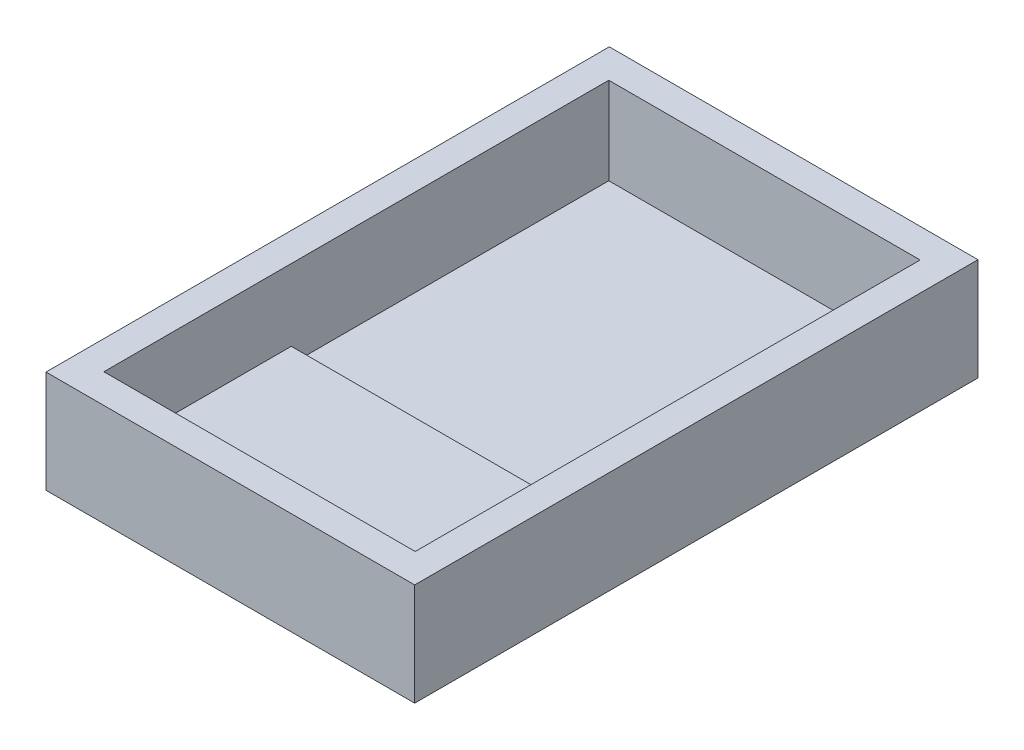
from build123d import *

# Parameters (mm, degrees)
SKETCH1_W           = 36
SKETCH1_H           = 55
BOSS_EXTRUDE1_DEPTH = 3
SKETCH2_W           = 36
SKETCH2_H           = 55
SKETCH2_W_2         = 30.4
SKETCH2_H_2         = 49.3
BOSS_EXTRUDE2_DEPTH = 7
SKETCH3_W           = 30.4
SKETCH3_H           = 31
CUT_EXTRUDE1_DEPTH  = 1.5


with BuildPart() as part:
    # Sketch1 → Boss-Extrude1 (new body)
    with BuildSketch(Plane(origin=(0, 0, 0), x_dir=(1, 0, 0), z_dir=(0, 1, 0))):
        with Locations((18, 27.5)):
            Rectangle(SKETCH1_W, SKETCH1_H)
    extrude(amount=BOSS_EXTRUDE1_DEPTH)

    # Sketch2 → Boss-Extrude2 (add)
    with BuildSketch(Plane(origin=(0, 3, 0), x_dir=(1, 0, 0), z_dir=(0, 1, 0))):
        with Locations((18, 27.5)):
            Rectangle(SKETCH2_W, SKETCH2_H)
        with Locations((18, 27.5)):
            Rectangle(SKETCH2_W_2, SKETCH2_H_2, mode=Mode.SUBTRACT)
    extrude(amount=BOSS_EXTRUDE2_DEPTH)

    # Sketch3 → Cut-Extrude1 (cut)
    with BuildSketch(Plane(origin=(0, 3, 0), x_dir=(1, 0, 0), z_dir=(0, 1, 0))):
        with Locations((18, 36.65)):
            Rectangle(SKETCH3_W, SKETCH3_H)
    extrude(amount=-CUT_EXTRUDE1_DEPTH, mode=Mode.SUBTRACT)


solid = part.part
